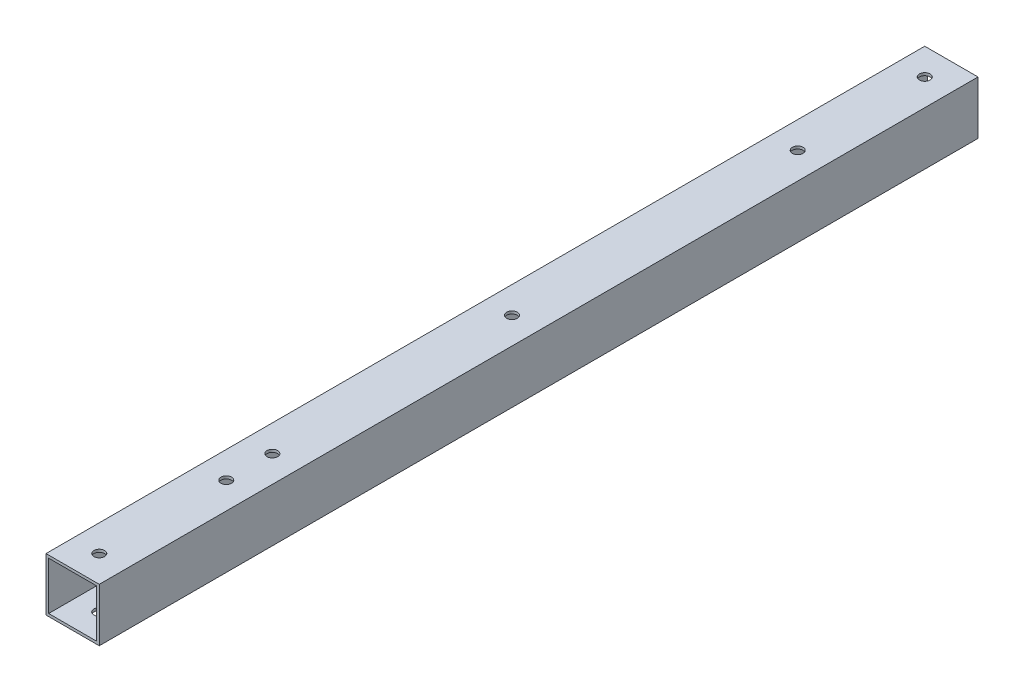
from build123d import *

# Parameters (mm, degrees)
SKETCH_1_W            = 20
SKETCH_1_H            = 20
SKETCH_1_W_2          = 18
SKETCH_1_H_2          = 18
EXTRUDE_1_DEPTH       = 165
MM_1_D                = 4
HOLE_WIZARD_4_0_4_1_D = 4
HOLE_WIZARD_4_0_4_2_D = 4


with BuildPart() as part:
    # 草图1 → 凸台-拉伸1 (new, symmetric)
    with BuildSketch(Plane.XY):
        Rectangle(SKETCH_1_W, SKETCH_1_H)
        Rectangle(SKETCH_1_W_2, SKETCH_1_H_2, mode=Mode.SUBTRACT)
    extrude(amount=EXTRUDE_1_DEPTH, both=True)

    # 大小mm 暗销孔1 (through all)
    with Locations(Plane(origin=(0, -10, 0), x_dir=(-1, 0, 0), z_dir=(0, -1, 0))):
        with Locations((0, -107.3)):
            mm_1 = Hole(MM_1_D / 2)

    # 镜向1: 大小mm 暗销孔1 across plane
    add(mm_1.mirror(Plane.XY), mode=Mode.SUBTRACT)

    # Ø4.0 (4) 直径孔1 (through all)
    with Locations(Plane(origin=(0, -10, 0), x_dir=(-1, 0, 0), z_dir=(0, -1, 0))):
        with Locations((0, -155)):
            hole_wizard_4_0_4_1 = Hole(HOLE_WIZARD_4_0_4_1_D / 2)

    # 镜向2: Ø4.0 (4) 直径孔1 across plane
    add(hole_wizard_4_0_4_1.mirror(Plane.XY), mode=Mode.SUBTRACT)

    # Ø4.0 (4) 直径孔2 (through all)
    with Locations(Plane(origin=(0, -10, 0), x_dir=(-1, 0, 0), z_dir=(0, -1, 0))):
        with Locations((0, -90), (0, 0)):
            Hole(HOLE_WIZARD_4_0_4_2_D / 2)


solid = part.part
